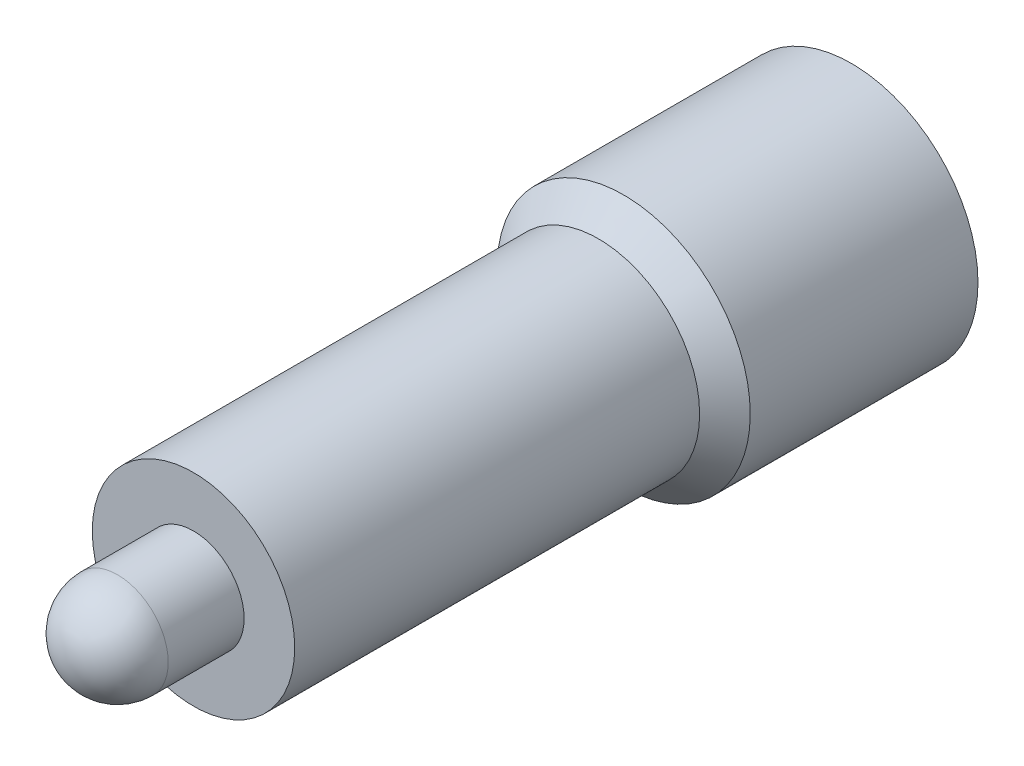
from build123d import *

# Parameters (mm, degrees)
SKETCH_1_R      = 5
EXTRUDE_1_DEPTH = 10
CHAMFER_1_SIZE  = 1
SKETCH_2_R      = 4
EXTRUDE_2_DEPTH = 16
SKETCH_3_R      = 2
EXTRUDE_3_DEPTH = 5
FILLET_1_R      = 2


with BuildPart() as part:
    # Эскиз1 → Бобышка-Вытянуть1 (new body)
    with BuildSketch(Plane.XY):
        Circle(SKETCH_1_R)
    extrude(amount=EXTRUDE_1_DEPTH)

    # Фаска1
    chamfer_1_edges = [part.edges().sort_by_distance(p)[0] for p in [
        (-5, 0, 10),
    ]]
    chamfer(chamfer_1_edges, length=CHAMFER_1_SIZE)

    # Эскиз2 → Бобышка-Вытянуть2 (add)
    with BuildSketch(Plane.XY.offset(10)):
        Circle(SKETCH_2_R)
    extrude(amount=EXTRUDE_2_DEPTH)

    # Эскиз3 → Бобышка-Вытянуть3 (add)
    with BuildSketch(Plane.XY.offset(26)):
        Circle(SKETCH_3_R)
    extrude(amount=EXTRUDE_3_DEPTH)

    # Скругление1
    fillet_1_edges = [part.edges().sort_by_distance(p)[0] for p in [
        (-2, 0, 31),
    ]]
    fillet(fillet_1_edges, radius=FILLET_1_R)


solid = part.part
